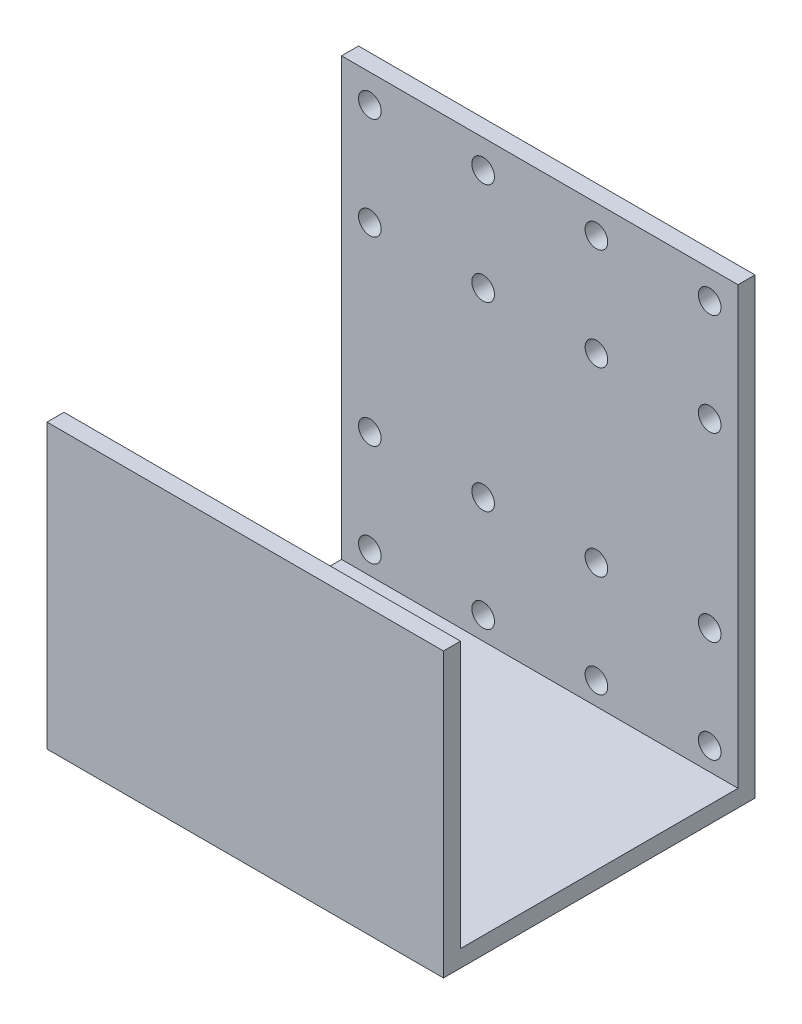
from build123d import *

# Parameters (mm, degrees)
SKETCH1_W               = 70
SKETCH1_H               = 80
BOSS_EXTRUDE1_DEPTH     = 55
CUT_EXTRUDE1_DEPTH      = 104.198837203
CUT_EXTRUDE1_DEPTH_BACK = 104.198837203
SKETCH2_W               = 27.5
SKETCH2_H               = 30
SHELL1_T                = -3
CUT_EXTRUDE2_DEPTH      = 101.891030325
SKETCH9_R               = 2
CUT_EXTRUDE3_DEPTH      = 102.631687972
LPATTERN1_COUNT         = 2
LPATTERN1_PITCH         = 40
LPATTERN1_COUNT_DIR2    = 2
LPATTERN1_PITCH_DIR2    = 50


with BuildPart() as part:
    # Sketch1 → Boss-Extrude1 (new body)
    with BuildSketch(Plane.XY):
        with Locations((0, -40)):
            Rectangle(SKETCH1_W, SKETCH1_H)
    extrude(amount=BOSS_EXTRUDE1_DEPTH)

    # Sketch2 → Cut-Extrude1 (cut, two sides: drawn at the far end of the back side and taken through both)
    with BuildSketch(Plane(origin=(0, 0, 0), x_dir=(0, 0, -1), z_dir=(1, 0, 0)).offset(-CUT_EXTRUDE1_DEPTH_BACK)):
        with Locations((-41.25, -15)):
            Rectangle(SKETCH2_W, SKETCH2_H)
    extrude(amount=CUT_EXTRUDE1_DEPTH + CUT_EXTRUDE1_DEPTH_BACK, mode=Mode.SUBTRACT)

    # Shell1
    shell1_openings = [part.faces().sort_by_distance(p)[0] for p in [
        (0, 0, 13.75),
        (35, -45.769230769, 24.326923077),
        (0, -15, 27.5),
        (-35, -45.769230769, 24.326923077),
        (0, -30, 41.25),
    ]]
    offset(amount=SHELL1_T, openings=shell1_openings, kind=Kind.INTERSECTION)

    # Sketch8 → Cut-Extrude2 (cut, through all)
    with BuildSketch(Plane(origin=(0, -77, 0), x_dir=(1, 0, 0), z_dir=(0, 1, 0))):
        with BuildLine():
            Line((-26.5, -23.45), (-35, -23.45))
            Line((-35, -23.45), (-35, -31.55))
            Line((-35, -31.55), (-26.5, -31.55))
            ThreePointArc((-26.5, -31.55), (-22.45, -27.5), (-26.5, -23.45))
        make_face()
    extrude(amount=-CUT_EXTRUDE2_DEPTH, mode=Mode.SUBTRACT)

    # Sketch9 → Cut-Extrude3 (cut, through all)
    with BuildSketch(Plane.XY.offset(3)):
        with Locations((-30, -5)):
            Circle(SKETCH9_R)
        with Locations((-10, -5)):
            Circle(SKETCH9_R)
        with Locations((-30, -23)):
            Circle(SKETCH9_R)
        with Locations((-10, -23)):
            Circle(SKETCH9_R)
    cut_extrude3 = extrude(amount=-CUT_EXTRUDE3_DEPTH, mode=Mode.SUBTRACT)

    # LPattern1: Cut-Extrude3 2 × 2
    with Locations(*[(i * LPATTERN1_PITCH, -j * LPATTERN1_PITCH_DIR2, 0) for i in range(LPATTERN1_COUNT) for j in range(LPATTERN1_COUNT_DIR2) if (i, j) != (0, 0)]):
        add(cut_extrude3, mode=Mode.SUBTRACT)


solid = part.part
